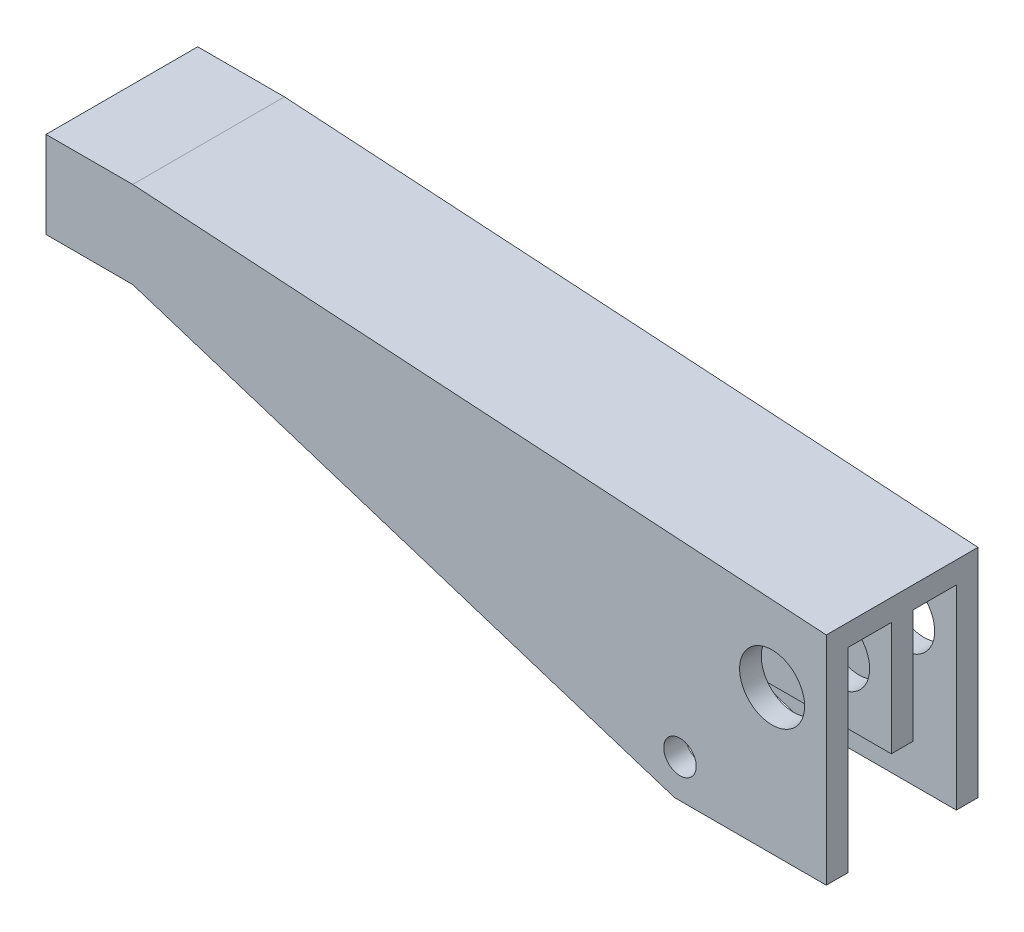
from build123d import *

# Parameters (mm, degrees)
BOSS_EXTRUDE1_DEPTH      = 25.4
BOSS_EXTRUDE2_DEPTH      = 25.4
BOSS_EXTRUDE3_DEPTH      = 152.4
BOSS_EXTRUDE4_DEPTH      = 12.7
BOSS_EXTRUDE4_DEPTH_BACK = 12.7
SKETCH5_R                = 38.1
SKETCH5_R_2              = 19.05
CUT_EXTRUDE1_DEPTH       = 981.124094184
CUT_EXTRUDE2_DEPTH       = 25.4
SCALE1_SCALE             = 2.84


with BuildPart() as part:
    # Sketch1 → Boss-Extrude1 (new body)
    with BuildSketch(Plane.XY):
        Polygon((-914.4, 304.8), (-812.8, 304.8), (0, 254), (0, 0), (-177.8, 0), (-812.8, 203.2), (-914.4, 203.2), align=None)
    extrude(amount=-BOSS_EXTRUDE1_DEPTH)



with BuildPart() as body_2:
    # Sketch2 → Boss-Extrude2 (new body)
    with BuildSketch(Plane.XY.offset(127)):
        Polygon((-812.8, 203.2), (-177.8, 0), (0, 0), (0, 254), (-812.8, 304.8), (-914.4, 304.8), (-914.4, 203.2), align=None)
    extrude(amount=BOSS_EXTRUDE2_DEPTH)


with BuildPart() as part_1:
    add(part.part)

    add(body_2.part)  # Boss-Extrude3 merges body 2
    # Sketch3 → Boss-Extrude3 (add)
    with BuildSketch(Plane.XY.offset(152.4)):
        Polygon((-914.4, 279.4), (-914.4, 304.8), (-812.8, 304.8), (0, 254), (0, 228.550438977), (-25.4, 230.137938977), (-813.592976364, 279.4), align=None)
    extrude(amount=-BOSS_EXTRUDE3_DEPTH)

    # Sketch6 → Boss-Extrude4 (add, two sides: drawn at the far end of the back side and taken through both)
    with BuildSketch(Plane.XY.offset(63.5).offset(-BOSS_EXTRUDE4_DEPTH_BACK)):
        Polygon((-812.8, 203.2), (-177.8, 0), (0, 0), (0, 254), (-812.8, 304.8), (-914.4, 304.8), (-914.4, 203.2), align=None)
    extrude(amount=BOSS_EXTRUDE4_DEPTH + BOSS_EXTRUDE4_DEPTH_BACK)

    # Sketch5 → Cut-Extrude1 (cut, through all)
    with BuildSketch(Plane.XY.offset(152.4)):
        with Locations((-63.5, 168.969627955)):
            Circle(SKETCH5_R)
        with Locations((-171.45, 44.45)):
            Circle(SKETCH5_R_2)
    extrude(amount=-CUT_EXTRUDE1_DEPTH, mode=Mode.SUBTRACT)

    # Sketch7 → Cut-Extrude2 (cut)
    with BuildSketch(Plane.XY.offset(76.2)):
        Polygon((-475.45625, 95.25), (0, 95.25), (0, 0), (-177.8, 0), align=None)
    extrude(amount=-CUT_EXTRUDE2_DEPTH, mode=Mode.SUBTRACT)


with BuildPart() as part_2:
    # Scale1: scaled about (-409.969923115, 196.838960964, 63.5)
    add(part_1.part.scale(SCALE1_SCALE).moved(Location((754.344658532, -362.183688174, -116.84))))


solid = part_2.part
